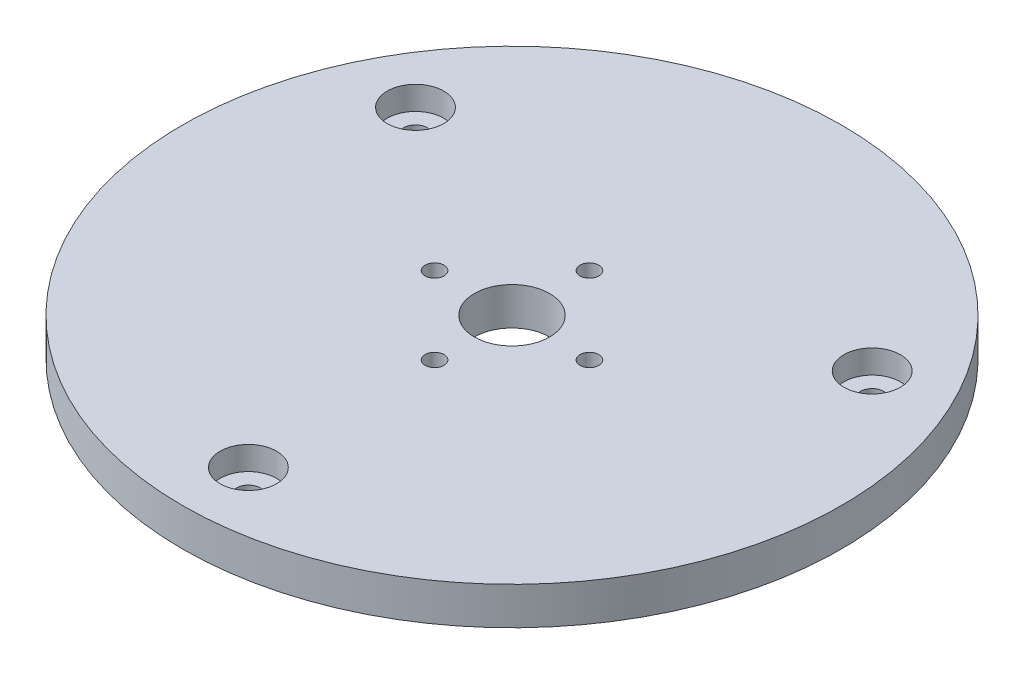
from build123d import *

# Parameters (mm, degrees)
SKETCH1_R           = 35
BOSS_EXTRUDE1_DEPTH = 4
SKETCH2_R           = 1
SKETCH2_R_2         = 1.25
CUT_EXTRUDE1_DEPTH  = 50.658836072
CUT_EXTRUDE2_REACH  = 51.659
SKETCH3_R           = 4
SKETCH4_R           = 3
CUT_EXTRUDE3_DEPTH  = 2.5
SKETCH5_R           = 2
CUT_EXTRUDE4_DEPTH  = 2.5


with BuildPart() as part:
    # Sketch1 → Boss-Extrude1 (new body)
    with BuildSketch(Plane(origin=(0, 0, 0), x_dir=(1, 0, 0), z_dir=(0, 1, 0))):
        with Locations(Location((0, 0, 0), (0, 0, 270))):
            Circle(SKETCH1_R)
    extrude(amount=BOSS_EXTRUDE1_DEPTH)

    # Sketch2 → Cut-Extrude1 (cut, through all)
    with BuildSketch(Plane(origin=(0, 4, 0), x_dir=(1, 0, 0), z_dir=(0, 1, 0))):
        with Locations(Location((0, 8.227062517, 0), (0, 0, 270))):
            Circle(SKETCH2_R)
        with Locations(Location((8.227062517, 0, 0), (0, 0, 270))):
            Circle(SKETCH2_R)
        with Locations(Location((0, -8.227062517, 0), (0, 0, 270))):
            Circle(SKETCH2_R)
        with Locations(Location((-8.227062517, 0, 0), (0, 0, 270))):
            Circle(SKETCH2_R)
        with Locations(Location((0, -28, 0), (0, 0, 90))):
            Circle(SKETCH2_R_2)
        with Locations(Location((-24.248711306, 14, 0), (0, 0, 90))):
            Circle(SKETCH2_R_2)
        with Locations(Location((24.248711306, 14, 0), (0, 0, 90))):
            Circle(SKETCH2_R_2)
    extrude(amount=-CUT_EXTRUDE1_DEPTH, mode=Mode.SUBTRACT)

    # Sketch3 → Cut-Extrude2 (cut, up to next)
    with BuildSketch(Plane.XZ, mode=Mode.PRIVATE) as cut_extrude2_sk1:
        with Locations(Location((0, 0, 0), (0, 0, 270))):
            Circle(SKETCH3_R)
    cut_extrude2_tool1 = extrude(cut_extrude2_sk1.sketch, amount=-CUT_EXTRUDE2_REACH, mode=Mode.PRIVATE) & part.part
    add(cut_extrude2_tool1.solids().sort_by_distance((0, 0, 0))[0], mode=Mode.SUBTRACT)

    # Sketch4 → Cut-Extrude3 (cut)
    with BuildSketch(Plane(origin=(0, 4, 0), x_dir=(1, 0, 0), z_dir=(0, 1, 0))):
        with Locations(Location((24.248711306, 14, 0), (0, 0, 270))):
            Circle(SKETCH4_R)
        with Locations(Location((0, -28, 0), (0, 0, 270))):
            Circle(SKETCH4_R)
        with Locations(Location((-24.248711306, 14, 0), (0, 0, 270))):
            Circle(SKETCH4_R)
    extrude(amount=-CUT_EXTRUDE3_DEPTH, mode=Mode.SUBTRACT)

    # Sketch5 → Cut-Extrude4 (cut)
    with BuildSketch(Plane.XZ):
        with Locations(Location((0, 8.227062517, 0), (0, 0, 270))):
            Circle(SKETCH5_R)
        with Locations(Location((8.227062517, 0, 0), (0, 0, 270))):
            Circle(SKETCH5_R)
        with Locations(Location((0, -8.227062517, 0), (0, 0, 270))):
            Circle(SKETCH5_R)
        with Locations(Location((-8.227062517, 0, 0), (0, 0, 270))):
            Circle(SKETCH5_R)
    extrude(amount=-CUT_EXTRUDE4_DEPTH, mode=Mode.SUBTRACT)


solid = part.part
